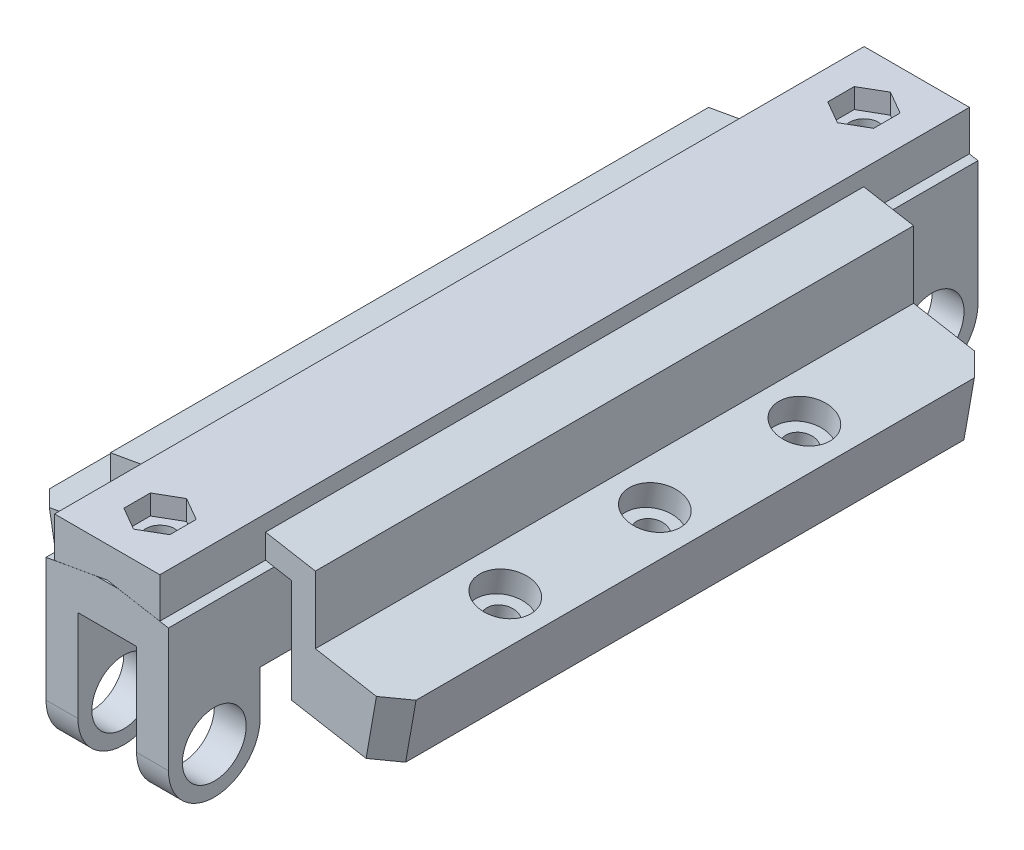
from build123d import *

# Parameters (mm, degrees)
BOSS_EXTRUDE1_DEPTH           = 37.5
BOSS_EXTRUDE4_DEPTH           = 75
CHAMFER1_SIZE                 = 2.5
BOSS_EXTRUDE6_DEPTH           = 50.75
SKETCH10_R                    = 4
BOSS_EXTRUDE7_DEPTH           = 4
LPATTERN1_COUNT               = 5
LPATTERN1_PITCH               = 22.5
BOSS_EXTRUDE9_DEPTH           = 75
BOSS_EXTRUDE10_START          = -88.25
BOSS_EXTRUDE10_DEPTH          = 101.5
CBORE_FOR_M3_SHCS1_AT_2_COUNT = 2
CBORE_FOR_M3_SHCS1_AT_2_PITCH = 88.25
CUT_EXTRUDE1_DEPTH            = 2.5
CBORE_FOR_M3_SHCS2_AT_2_COUNT = 2
CBORE_FOR_M3_SHCS2_AT_2_PITCH = 18.75
CBORE_FOR_M3_SHCS2_AT_3_COUNT = 2
CBORE_FOR_M3_SHCS2_AT_3_PITCH = 37.5
SKETCH19_W                    = 4
SKETCH19_H                    = 101.5
CUT_EXTRUDE2_DEPTH            = 0.25


with BuildPart() as part:
    # Sketch2 → Boss-Extrude1 (new, symmetric)
    with BuildSketch(Plane.XY):
        Polygon((0, 0), (-9.84807753, -1.736481777), (-10.369022063, 1.217941482), (0, 3.046279836), (10.369022063, 1.217941482), (9.84807753, -1.736481777), align=None)
    extrude(amount=BOSS_EXTRUDE1_DEPTH, both=True)

    # Sketch5 → Boss-Extrude4 (add)
    with BuildSketch(Plane.XY.offset(37.5)):
        Polygon((-9.84807753, -1.736481777), (-9.84807753, -14.736481777), (-21.665770566, -16.820259909), (-22.968131899, -9.434201761), (-12.84807753, -7.64976313), (-12.84807753, 0.780817117), (-10.369022063, 1.217941482), align=None)
        Polygon((10.369022063, 1.217941482), (9.84807753, -1.736481777), (9.84807753, -14.736481777), (21.665770566, -16.820259909), (22.968131899, -9.434201761), (12.84807753, -7.64976313), (12.84807753, 0.780817117), align=None)
    extrude(amount=-BOSS_EXTRUDE4_DEPTH)

    # Chamfer1
    chamfer1_edges = [part.edges().sort_by_distance(p)[0] for p in [
        (-22.316951233, -13.127230835, 37.5),
        (-22.316951233, -13.127230835, -37.5),
        (22.316951233, -13.127230835, 37.5),
        (22.316951233, -13.127230835, -37.5),
    ]]
    chamfer(chamfer1_edges, length=CHAMFER1_SIZE)

    # Sketch11 → Boss-Extrude9 (add)
    with BuildSketch(Plane.XY.offset(37.5)):
        Polygon((-6.6, 1.882521763), (-6.6, 3.882521763), (6.6, 3.882521763), (6.6, 1.882521763), (0, 3.046279836), align=None)
    extrude(amount=-BOSS_EXTRUDE9_DEPTH)

    # Sketch18 → Boss-Extrude10 (add)
    with BuildSketch(Plane(origin=(0, 0, -37.5), x_dir=(-1, 0, 0), z_dir=(0, 0, -1)).offset(BOSS_EXTRUDE10_START)):
        Polygon((-6.6, 3.882521763), (-6.6, 1.882521763), (-6.6, -1.163758073), (0, 0), (6.6, -1.163758073), (6.6, 1.882521763), (6.6, 3.882521763), align=None)
    extrude(amount=BOSS_EXTRUDE10_DEPTH)


with BuildPart() as body_2:
    # Sketch8 → Boss-Extrude6 (new, symmetric)
    with BuildSketch(Plane.XY):
        Polygon((-7.675, -1.363309577), (-7.675, -11.363309577), (-3.675, -11.363309577), (-3.675, -5.363309577), (0, -5.363309577), (0, -0.01), align=None)
    extrude(amount=BOSS_EXTRUDE6_DEPTH, both=True)

    # Sketch10 → Boss-Extrude7 (add)
    # profile 1 of 3: a face of its own
    with BuildSketch(Plane(origin=(-3.675, 0, 0), x_dir=(0, 0, -1), z_dir=(1, 0, 0))):
        with BuildLine():
            Line((-39.25, -11.363309577), (-50.75, -11.363309577))
            Line((-50.75, -11.363309577), (-50.75, -16.863309577))
            ThreePointArc((-50.75, -16.863309577), (-45, -22.613309577), (-39.25, -16.863309577))
            Line((-39.25, -16.863309577), (-39.25, -11.363309577))
        make_face()
        with Locations(Location((-45, -16.863309577, 0), (0, 0, 90))):
            Circle(SKETCH10_R, mode=Mode.SUBTRACT)
    # profile 2 of 3: a face of its own
    with BuildSketch(Plane(origin=(-3.675, 0, 0), x_dir=(0, 0, -1), z_dir=(1, 0, 0))):
        with BuildLine():
            Line((-39.25, -11.363309577), (-50.75, -11.363309577))
            Line((-50.75, -11.363309577), (-50.75, -16.863309577))
            ThreePointArc((-50.75, -16.863309577), (-45, -22.613309577), (-39.25, -16.863309577))
            Line((-39.25, -16.863309577), (-39.25, -11.363309577))
        make_face()
        with Locations(Location((-45, -16.863309577, 0), (0, 0, 90))):
            Circle(SKETCH10_R, mode=Mode.SUBTRACT)
    # profile 3 of 3: a face of its own
    with BuildSketch(Plane(origin=(-3.675, 0, 0), x_dir=(0, 0, -1), z_dir=(1, 0, 0))):
        with BuildLine():
            Line((-39.25, -11.363309577), (-50.75, -11.363309577))
            Line((-50.75, -11.363309577), (-50.75, -16.863309577))
            ThreePointArc((-50.75, -16.863309577), (-45, -22.613309577), (-39.25, -16.863309577))
            Line((-39.25, -16.863309577), (-39.25, -11.363309577))
        make_face()
        with Locations(Location((-45, -16.863309577, 0), (0, 0, 90))):
            Circle(SKETCH10_R, mode=Mode.SUBTRACT)
    boss_extrude7 = extrude(amount=-BOSS_EXTRUDE7_DEPTH)

    # LPattern1: Boss-Extrude7 ×5
    with Locations(*[(0, 0, -i * LPATTERN1_PITCH) for i in range(1, LPATTERN1_COUNT)]):
        add(boss_extrude7)

    # Mirror8: body 2 across plane


with BuildPart() as body_2_1:
    add(body_2.part)
    add(body_2.part.mirror(Plane(origin=(0, 0, 0), x_dir=(0, 0, 1), z_dir=(1, 0, 0))))


with BuildPart() as cbore_for_m3_shcs1_tool:
    # Sketch14 → CBORE for M3 SHCS1 (revolve)
    with BuildSketch(Plane(origin=(0, -5.363309577, 44.125), x_dir=(0, 0, -1), z_dir=(1, 0, 0))):
        Polygon((0, 0), (0, 9.24583134), (1.8, 9.24583134), (1.8, 3), (3.25, 3), (3.25, 0), align=None)
    cbore_for_m3_shcs1 = revolve(axis=Axis((0, -11.713309577, 44.125), (0, 1, 0)))


with BuildPart() as part_1:
    add(part.part)

    # CBORE for M3 SHCS1: cut by cbore_for_m3_shcs1_tool
    add(cbore_for_m3_shcs1_tool.part, mode=Mode.SUBTRACT)


with BuildPart() as body_2_2:
    add(body_2_1.part)

    # CBORE for M3 SHCS1: cut by cbore_for_m3_shcs1_tool
    add(cbore_for_m3_shcs1_tool.part, mode=Mode.SUBTRACT)


with BuildPart() as cbore_for_m3_shcs1_at_2_tool:
    # CBORE for M3 SHCS1 at 2: CBORE for M3 SHCS1 ×2
    with Locations(*[(0, 0, -i * CBORE_FOR_M3_SHCS1_AT_2_PITCH) for i in range(1, CBORE_FOR_M3_SHCS1_AT_2_COUNT)]):
        add(cbore_for_m3_shcs1)


with BuildPart() as part_2:
    add(part_1.part)

    # CBORE for M3 SHCS1 at 2: cut by cbore_for_m3_shcs1_at_2_tool
    add(cbore_for_m3_shcs1_at_2_tool.part, mode=Mode.SUBTRACT)

    # Sketch15 → Cut-Extrude1 (cut)
    with BuildSketch(Plane(origin=(0, 3.882521763, 0), x_dir=(1, 0, 0), z_dir=(0, 1, 0))):
        Polygon((0, -40.805235952), (2.875, -42.465117976), (2.875, -45.784882024), (0, -47.444764048), (-2.875, -45.784882024), (-2.875, -42.465117976), align=None)
        Polygon((2.875, 42.465117976), (2.875, 45.784882024), (0, 47.444764048), (-2.875, 45.784882024), (-2.875, 42.465117976), (0, 40.805235952), align=None)
    extrude(amount=-CUT_EXTRUDE1_DEPTH, mode=Mode.SUBTRACT)

    # Sketch17 → CBORE for M3 SHCS2 (revolve, cut)
    with BuildSketch(Plane(origin=(-17.908104714, -8.541982445, 18.75), x_dir=(-0.9848077530122079, -0.1736481776669312, 0), z_dir=(0, 0, 1))):
        Polygon((0, 0), (0, 18.300011567), (1.8, 18.300011567), (1.8, 3), (3.25, 3), (3.25, 0), align=None)
    cbore_for_m3_shcs2 = revolve(axis=Axis((-19.010770643, -2.288453214, 18.75), (0.1736481776669312, -0.9848077530122079, 0)), mode=Mode.SUBTRACT)

    # CBORE for M3 SHCS2 at 2: CBORE for M3 SHCS2 ×2
    with Locations(*[(0, 0, -i * CBORE_FOR_M3_SHCS2_AT_2_PITCH) for i in range(1, CBORE_FOR_M3_SHCS2_AT_2_COUNT)]):
        add(cbore_for_m3_shcs2, mode=Mode.SUBTRACT)

    # CBORE for M3 SHCS2 at 3: CBORE for M3 SHCS2 ×2
    with Locations(*[(0, 0, -i * CBORE_FOR_M3_SHCS2_AT_3_PITCH) for i in range(1, CBORE_FOR_M3_SHCS2_AT_3_COUNT)]):
        add(cbore_for_m3_shcs2, mode=Mode.SUBTRACT)

    # Mirror9: CBORE for M3 SHCS2 across plane
    add(cbore_for_m3_shcs2.mirror(Plane(origin=(0, 0, 0), x_dir=(0, 0, 1), z_dir=(1, 0, 0))), mode=Mode.SUBTRACT)

    # Mirror9 copy 1 sketch → Mirror9 copy 1 (revolve, cut)
    with BuildSketch(Plane(origin=(17.908104714, -8.541982445, 0), x_dir=(0.9848077530122079, -0.1736481776669312, 0), z_dir=(0, 0, 1))):
        Polygon((0, 0), (0, -18.300011567), (1.8, -18.300011567), (1.8, -3), (3.25, -3), (3.25, 0), align=None)
    revolve(axis=Axis((19.010770643, -2.288453214, 0), (0.1736481776669312, 0.9848077530122079, 0)), mode=Mode.SUBTRACT)

    # Mirror9 copy 2 sketch → Mirror9 copy 2 (revolve, cut)
    with BuildSketch(Plane(origin=(17.908104714, -8.541982445, -18.75), x_dir=(0.9848077530122079, -0.1736481776669312, 0), z_dir=(0, 0, 1))):
        Polygon((0, 0), (0, -18.300011567), (1.8, -18.300011567), (1.8, -3), (3.25, -3), (3.25, 0), align=None)
    revolve(axis=Axis((19.010770643, -2.288453214, -18.75), (0.1736481776669312, 0.9848077530122079, 0)), mode=Mode.SUBTRACT)


with BuildPart() as body_2_3:
    add(body_2_2.part)

    # CBORE for M3 SHCS1 at 2: cut by cbore_for_m3_shcs1_at_2_tool
    add(cbore_for_m3_shcs1_at_2_tool.part, mode=Mode.SUBTRACT)

    # Sketch19 → Cut-Extrude2 (cut)
    with BuildSketch(Plane(origin=(0, 0, 0), x_dir=(1, 0, 0), z_dir=(0, 1, 0))):
        Rectangle(SKETCH19_W, SKETCH19_H)
    extrude(amount=-CUT_EXTRUDE2_DEPTH, mode=Mode.SUBTRACT)


solid = Compound([part_2.part, body_2_3.part])
